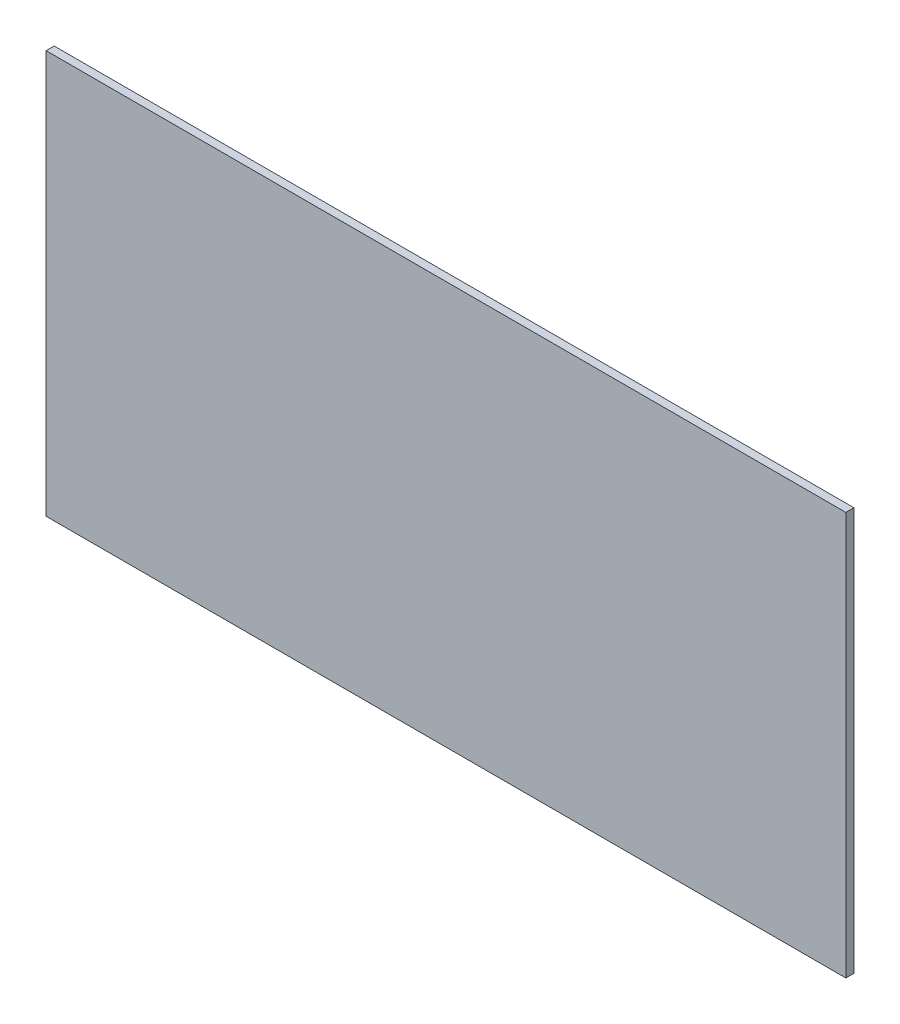
from build123d import *

# Parameters (mm, degrees)
SKETCH_1_W      = 595
SKETCH_1_H      = 300
EXTRUDE_1_DEPTH = 6


with BuildPart() as part:
    # Эскиз1 → Бобышка-Вытянуть1 (new body)
    with BuildSketch(Plane.XY):
        Rectangle(SKETCH_1_W, SKETCH_1_H)
    extrude(amount=EXTRUDE_1_DEPTH)


solid = part.part
